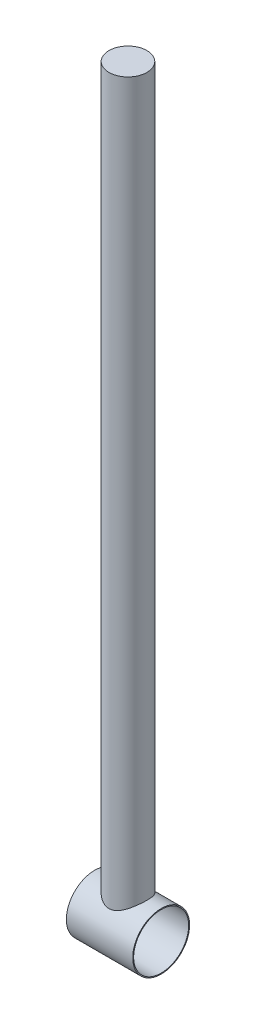
from build123d import *

# Parameters (mm, degrees)
SKETCH2_R                = 30
SKETCH2_R_2              = 29
BOSS_EXTRUDE3_DEPTH      = 35
BOSS_EXTRUDE4_REACH      = 843
BOSS_EXTRUDE4_END_RADIUS = 30
BOSS_EXTRUDE4_START      = 786
SKETCH1_R                = 20


with BuildPart() as part:
    # Sketch2 → Boss-Extrude3 (new, symmetric)
    with BuildSketch(Plane(origin=(0, 0, 0), x_dir=(0, 0, -1), z_dir=(1, 0, 0))):
        Circle(SKETCH2_R)
        Circle(SKETCH2_R_2, mode=Mode.SUBTRACT)
    extrude(amount=BOSS_EXTRUDE3_DEPTH, both=True)

    # Boss-Extrude4: up to this cylinder (the profile starts outside it)
    boss_extrude4_end = Plane(origin=(0, 0, 0), z_dir=(-1, 0, 0)) * Cylinder(BOSS_EXTRUDE4_END_RADIUS, 1747, mode=Mode.PRIVATE)
    # Sketch1 → Boss-Extrude4 (add, up to the surface)
    with BuildSketch(Plane(origin=(0, 0, 0), x_dir=(1, 0, 0), z_dir=(0, 1, 0)).offset(BOSS_EXTRUDE4_START), mode=Mode.PRIVATE) as boss_extrude4_sk1:
        with Locations(Location((0, 0, 0), (0, 0, 270))):
            Circle(SKETCH1_R)
    boss_extrude4_tool1 = extrude(boss_extrude4_sk1.sketch, amount=-BOSS_EXTRUDE4_REACH, mode=Mode.PRIVATE) - boss_extrude4_end
    add(boss_extrude4_tool1.solids().sort_by_distance((0, 786, 0))[0])


solid = part.part
